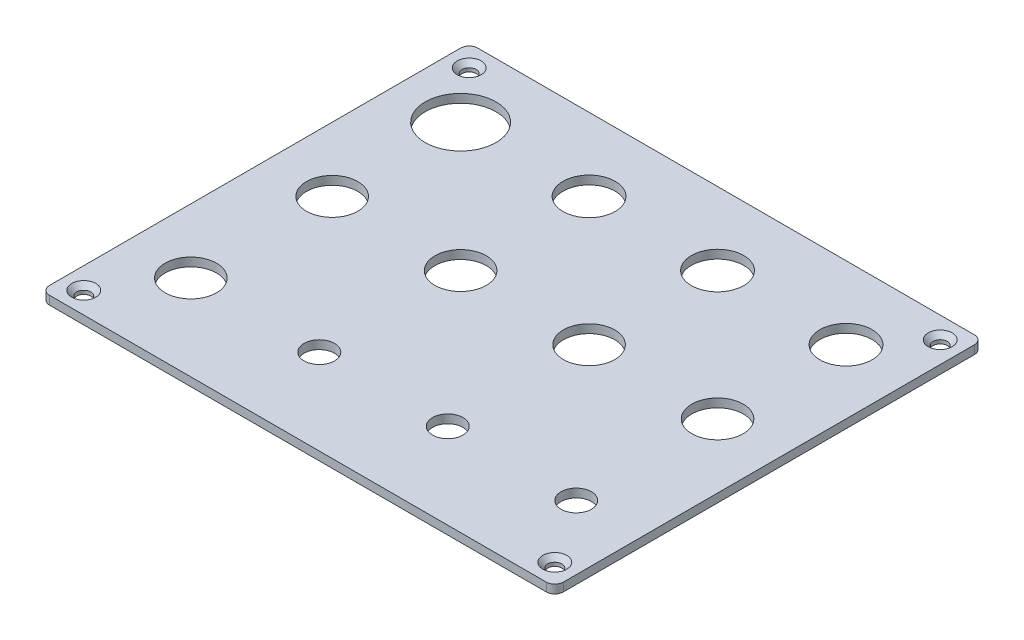
from build123d import *

# Parameters (mm, degrees)
BOTTOM_PLATE_W                       = 120
BOTTOM_PLATE_H                       = 100
BOTTOM_PLATE_EXT_DEPTH               = 2
MIDDLE_ROW_R                         = 6
MIDDLE_ROW_CUT_DEPTH                 = 157.217796681
TOP_ROW_R                            = 8.25
TOP_ROW_R_2                          = 6.1
TOP_ROW_CUT_DEPTH                    = 157.217796681
BOTTOM_ROW_R                         = 3.55
BOTTOM_ROW_R_2                       = 6
BOTTOM_ROW_CUT_DEPTH                 = 157.217796681
PLATE_SCREWS_R                       = 1.65
PLATE_SCREWS_CUT_DEPTH               = 157.217796681
PLATE_SCREW_HEAD_R                   = 2.8
PLATE_SCREW_HEAD_CUT_DEPTH           = 2
PLATE_SCREW_HEAD_CUT_DRAFT           = -45
PLATE_SCREW_HEAD_CUT_PROFILE_2_DEPTH = 2
PLATE_SCREW_HEAD_CUT_PROFILE_2_DRAFT = -45
PLATE_SCREW_HEAD_CUT_PROFILE_3_DEPTH = 2
PLATE_SCREW_HEAD_CUT_PROFILE_3_DRAFT = -45
PLATE_SCREW_HEAD_CUT_PROFILE_4_DEPTH = 2
PLATE_SCREW_HEAD_CUT_PROFILE_4_DRAFT = -45
FILLET1_R                            = 2
FILLET2_R                            = 2
FILLET3_R                            = 2
FILLET4_R                            = 2


with BuildPart() as part:
    # Bottom Plate → Bottom Plate EXT (new body)
    with BuildSketch(Plane(origin=(0, 0, 0), x_dir=(1, 0, 0), z_dir=(0, 1, 0))):
        with Locations((-60, 50)):
            Rectangle(BOTTOM_PLATE_W, BOTTOM_PLATE_H)
    extrude(amount=BOTTOM_PLATE_EXT_DEPTH)

    # Middle Row → Middle Row Cut (cut, through all)
    with BuildSketch(Plane(origin=(0, 2, 0), x_dir=(1, 0, 0), z_dir=(0, 1, 0))):
        with Locations(Location((-105, 53, 0), (0, 0, 270))):
            Circle(MIDDLE_ROW_R)
        with Locations(Location((-75, 53, 0), (0, 0, 270))):
            Circle(MIDDLE_ROW_R)
        with Locations(Location((-45, 53, 0), (0, 0, 270))):
            Circle(MIDDLE_ROW_R)
        with Locations(Location((-15, 53, 0), (0, 0, 270))):
            Circle(MIDDLE_ROW_R)
    extrude(amount=-MIDDLE_ROW_CUT_DEPTH, mode=Mode.SUBTRACT)

    # Top Row → Top Row Cut (cut, through all)
    with BuildSketch(Plane(origin=(0, 2, 0), x_dir=(1, 0, 0), z_dir=(0, 1, 0))):
        with Locations(Location((-105, 83, 0), (0, 0, 270))):
            Circle(TOP_ROW_R)
        with Locations(Location((-75, 83, 0), (0, 0, 270))):
            Circle(TOP_ROW_R_2)
        with Locations(Location((-45, 83, 0), (0, 0, 270))):
            Circle(TOP_ROW_R_2)
        with Locations(Location((-15, 83, 0), (0, 0, 270))):
            Circle(TOP_ROW_R_2)
    extrude(amount=-TOP_ROW_CUT_DEPTH, mode=Mode.SUBTRACT)

    # Bottom Row → Bottom Row Cut (cut, through all)
    with BuildSketch(Plane(origin=(0, 2, 0), x_dir=(1, 0, 0), z_dir=(0, 1, 0))):
        with Locations(Location((-75, 20, 0), (0, 0, 270))):
            Circle(BOTTOM_ROW_R)
        with Locations(Location((-45, 20, 0), (0, 0, 270))):
            Circle(BOTTOM_ROW_R)
        with Locations(Location((-15, 20, 0), (0, 0, 270))):
            Circle(BOTTOM_ROW_R)
        with Locations(Location((-105, 20, 0), (0, 0, 270))):
            Circle(BOTTOM_ROW_R_2)
    extrude(amount=-BOTTOM_ROW_CUT_DEPTH, mode=Mode.SUBTRACT)

    # Plate Screws → Plate Screws Cut (cut, through all)
    with BuildSketch(Plane(origin=(0, 2, 0), x_dir=(1, 0, 0), z_dir=(0, 1, 0))):
        with Locations(Location((-115, 95, 0), (0, 0, 270))):
            Circle(PLATE_SCREWS_R)
        with Locations(Location((-5, 95, 0), (0, 0, 270))):
            Circle(PLATE_SCREWS_R)
        with Locations(Location((-5, 5, 0), (0, 0, 270))):
            Circle(PLATE_SCREWS_R)
        with Locations(Location((-115, 5, 0), (0, 0, 270))):
            Circle(PLATE_SCREWS_R)
    extrude(amount=-PLATE_SCREWS_CUT_DEPTH, mode=Mode.SUBTRACT)


with BuildPart() as plate_screw_head_cut_tool:
    # Plate Screw Head → Plate Screw Head Cut (with draft: the straight prism first)
    with BuildSketch(Plane(origin=(0, 2, 0), x_dir=(1, 0, 0), z_dir=(0, 1, 0))):
        with Locations((-115, 95)):
            Circle(PLATE_SCREW_HEAD_R)
    extrude(amount=-PLATE_SCREW_HEAD_CUT_DEPTH)
    # Plate Screw Head Cut: the draft: its side faces are tilted about the plane it starts from
    plate_screw_head_cut_sides = [plate_screw_head_cut_tool.faces().sort_by_distance(p)[0] for p in [
        (-117.8, 1, -95),
    ]]
    draft(plate_screw_head_cut_sides, Plane(origin=(0, 2, 0), x_dir=(1, 0, 0), z_dir=(0, 1, 0)), PLATE_SCREW_HEAD_CUT_DRAFT)


with BuildPart() as part_1:
    add(part.part)

    # Plate Screw Head Cut: cut by plate_screw_head_cut_tool
    add(plate_screw_head_cut_tool.part, mode=Mode.SUBTRACT)


with BuildPart() as plate_screw_head_cut_profile_2_tool:
    # Plate Screw Head → Plate Screw Head Cut profile 2 (with draft: the straight prism first)
    with BuildSketch(Plane(origin=(0, 2, 0), x_dir=(1, 0, 0), z_dir=(0, 1, 0))):
        with Locations((-5, 95)):
            Circle(PLATE_SCREW_HEAD_R)
    extrude(amount=-PLATE_SCREW_HEAD_CUT_PROFILE_2_DEPTH)
    # Plate Screw Head Cut profile 2: the draft: its side faces are tilted about the plane it starts from
    plate_screw_head_cut_profile_2_sides = [plate_screw_head_cut_profile_2_tool.faces().sort_by_distance(p)[0] for p in [
        (-7.8, 1, -95),
    ]]
    draft(plate_screw_head_cut_profile_2_sides, Plane(origin=(0, 2, 0), x_dir=(1, 0, 0), z_dir=(0, 1, 0)), PLATE_SCREW_HEAD_CUT_PROFILE_2_DRAFT)


with BuildPart() as part_2:
    add(part_1.part)

    # Plate Screw Head Cut profile 2: cut by plate_screw_head_cut_profile_2_tool
    add(plate_screw_head_cut_profile_2_tool.part, mode=Mode.SUBTRACT)


with BuildPart() as plate_screw_head_cut_profile_3_tool:
    # Plate Screw Head → Plate Screw Head Cut profile 3 (with draft: the straight prism first)
    with BuildSketch(Plane(origin=(0, 2, 0), x_dir=(1, 0, 0), z_dir=(0, 1, 0))):
        with Locations((-5, 5)):
            Circle(PLATE_SCREW_HEAD_R)
    extrude(amount=-PLATE_SCREW_HEAD_CUT_PROFILE_3_DEPTH)
    # Plate Screw Head Cut profile 3: the draft: its side faces are tilted about the plane it starts from
    plate_screw_head_cut_profile_3_sides = [plate_screw_head_cut_profile_3_tool.faces().sort_by_distance(p)[0] for p in [
        (-7.8, 1, -5),
    ]]
    draft(plate_screw_head_cut_profile_3_sides, Plane(origin=(0, 2, 0), x_dir=(1, 0, 0), z_dir=(0, 1, 0)), PLATE_SCREW_HEAD_CUT_PROFILE_3_DRAFT)


with BuildPart() as part_3:
    add(part_2.part)

    # Plate Screw Head Cut profile 3: cut by plate_screw_head_cut_profile_3_tool
    add(plate_screw_head_cut_profile_3_tool.part, mode=Mode.SUBTRACT)


with BuildPart() as plate_screw_head_cut_profile_4_tool:
    # Plate Screw Head → Plate Screw Head Cut profile 4 (with draft: the straight prism first)
    with BuildSketch(Plane(origin=(0, 2, 0), x_dir=(1, 0, 0), z_dir=(0, 1, 0))):
        with Locations((-115, 5)):
            Circle(PLATE_SCREW_HEAD_R)
    extrude(amount=-PLATE_SCREW_HEAD_CUT_PROFILE_4_DEPTH)
    # Plate Screw Head Cut profile 4: the draft: its side faces are tilted about the plane it starts from
    plate_screw_head_cut_profile_4_sides = [plate_screw_head_cut_profile_4_tool.faces().sort_by_distance(p)[0] for p in [
        (-117.8, 1, -5),
    ]]
    draft(plate_screw_head_cut_profile_4_sides, Plane(origin=(0, 2, 0), x_dir=(1, 0, 0), z_dir=(0, 1, 0)), PLATE_SCREW_HEAD_CUT_PROFILE_4_DRAFT)


with BuildPart() as part_4:
    add(part_3.part)

    # Plate Screw Head Cut profile 4: cut by plate_screw_head_cut_profile_4_tool
    add(plate_screw_head_cut_profile_4_tool.part, mode=Mode.SUBTRACT)

    # Fillet1
    fillet1_edges = [part_4.edges().sort_by_distance(p)[0] for p in [
        (-120, 1, -100),
    ]]
    fillet(fillet1_edges, radius=FILLET1_R)

    # Fillet2
    fillet2_edges = [part_4.edges().sort_by_distance(p)[0] for p in [
        (0, 1, -100),
    ]]
    fillet(fillet2_edges, radius=FILLET2_R)

    # Fillet3
    fillet3_edges = [part_4.edges().sort_by_distance(p)[0] for p in [
        (0, 1, 0),
    ]]
    fillet(fillet3_edges, radius=FILLET3_R)

    # Fillet4
    fillet4_edges = [part_4.edges().sort_by_distance(p)[0] for p in [
        (-120, 1, 0),
    ]]
    fillet(fillet4_edges, radius=FILLET4_R)


solid = part_4.part
